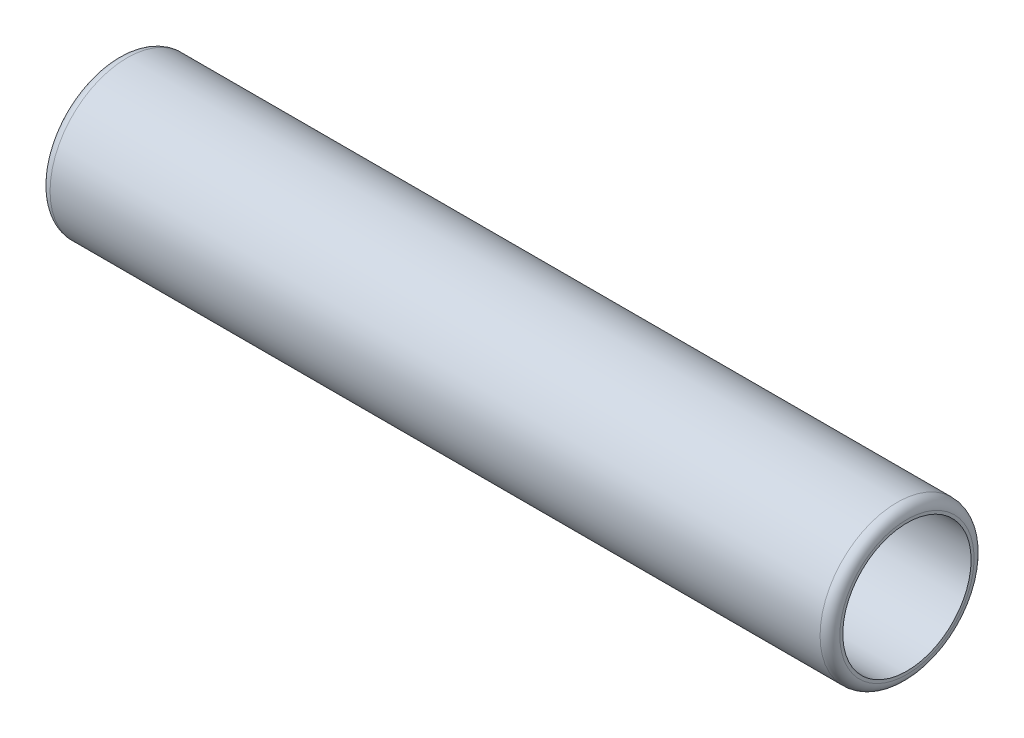
from build123d import *

# Parameters (mm, degrees)
ESBO_O1_W                  = 80
ESBO_O1_H                  = 7.8
ESBO_O2_R                  = 6.5
CORTE_EXTRUS_O1_DEPTH      = 25
CORTE_EXTRUS_O2_DEPTH      = 57.095276093
CORTE_EXTRUS_O2_DEPTH_BACK = 57.095276093
ESBO_O3_R                  = 4.25
FILETE1_R                  = 1


with BuildPart() as part:
    # Esboço1 → Revolução1 (revolve)
    with BuildSketch(Plane.XY, mode=Mode.PRIVATE) as revolu_o1_sk:
        with Locations((0, 3.9)):
            Rectangle(ESBO_O1_W, ESBO_O1_H)
    revolve(revolu_o1_sk.sketch.rotate(Axis((-40, 0, 0), (1, 0, 0)), 90), axis=Axis((-40, 0, 0), (1, 0, 0)))

    # Esboço2 → Corte-extrusão1 (cut)
    with BuildSketch(Plane(origin=(40, 0, 0), x_dir=(0, 0, -1), z_dir=(1, 0, 0))):
        Circle(ESBO_O2_R)
    extrude(amount=-CORTE_EXTRUS_O1_DEPTH, mode=Mode.SUBTRACT)

    # Esboço3 → Corte-extrusão2 (cut, two sides: drawn at the far end of the back side and taken through both)
    with BuildSketch(Plane(origin=(15, 0, 0), x_dir=(0, 0, -1), z_dir=(1, 0, 0)).offset(-CORTE_EXTRUS_O2_DEPTH_BACK)):
        Circle(ESBO_O3_R)
    extrude(amount=CORTE_EXTRUS_O2_DEPTH + CORTE_EXTRUS_O2_DEPTH_BACK, mode=Mode.SUBTRACT)

    # Filete1
    filete1_edges = [part.edges().sort_by_distance(p)[0] for p in [
        (-40, 0, -7.8),
        (40, 0, -7.8),
    ]]
    fillet(filete1_edges, radius=FILETE1_R)


solid = part.part
